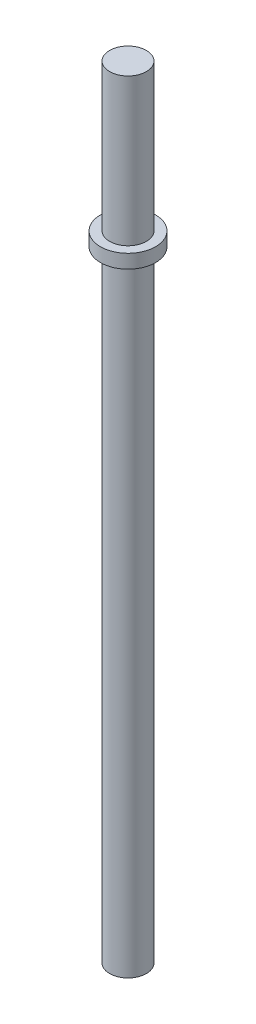
from build123d import *

# Parameters (mm, degrees)
SKETCH1_R           = 4
BOSS_EXTRUDE1_DEPTH = 170
SKETCH16_W          = 6
SKETCH16_H          = 3


with BuildPart() as part:
    # Sketch1 → Boss-Extrude1 (new body)
    with BuildSketch(Plane(origin=(0, 0, 0), x_dir=(1, 0, 0), z_dir=(0, 1, 0))):
        with Locations(Location((0, 0, 0), (0, 0, 270))):
            Circle(SKETCH1_R)
    extrude(amount=BOSS_EXTRUDE1_DEPTH)

    # Sketch16 → Revolve1 (revolve)
    with BuildSketch(Plane.XY, mode=Mode.PRIVATE) as revolve1_sk:
        with Locations((3, 136.5)):
            Rectangle(SKETCH16_W, SKETCH16_H)
    revolve(revolve1_sk.sketch.rotate(Axis((0, 135, 0), (0, 1, 0)), 90), axis=Axis((0, 135, 0), (0, 1, 0)))


solid = part.part
